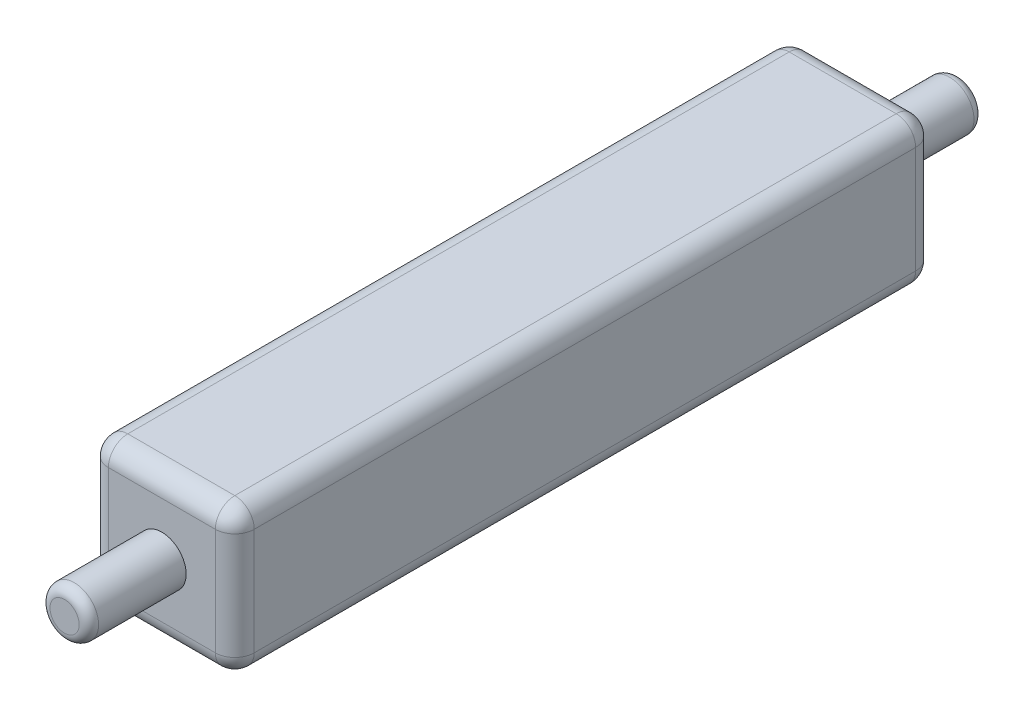
from build123d import *

# Parameters (mm, degrees)
SKETCH1_W           = 15
SKETCH1_H           = 15
BOSS_EXTRUDE1_DEPTH = 72
SKETCH2_R           = 2.5
BOSS_EXTRUDE2_DEPTH = 10
BOSS_EXTRUDE3_START = 10
SKETCH3_R           = 2.5
BOSS_EXTRUDE3_DEPTH = 10
CUT_EXTRUDE1_DEPTH  = 10
FILLET1_R           = 2
FILLET2_R           = 2
FILLET3_R           = 2
FILLET4_R           = 2
FILLET5_R           = 2
FILLET6_R           = 2
FILLET7_R           = 1
FILLET8_R           = 1


with BuildPart() as part:
    # Sketch1 → Boss-Extrude1 (new body)
    with BuildSketch(Plane.XY):
        with Locations((-7.5, 7.5)):
            Rectangle(SKETCH1_W, SKETCH1_H)
    extrude(amount=BOSS_EXTRUDE1_DEPTH)

    # Sketch2 → Boss-Extrude2 (add)
    with BuildSketch(Plane(origin=(0, 0, 0), x_dir=(-1, 0, 0), z_dir=(0, 0, -1))):
        with Locations((7.5, 7.5)):
            Circle(SKETCH2_R)
    extrude(amount=BOSS_EXTRUDE2_DEPTH)

    # Sketch3 → Boss-Extrude3 (add)
    with BuildSketch(Plane.XY.offset(72).offset(BOSS_EXTRUDE3_START)):
        with Locations(Location((-7.5, 7.5, 0), (0, 0, 180))):
            Circle(SKETCH3_R)
    extrude(amount=-BOSS_EXTRUDE3_DEPTH)

    # Sketch5 → Cut-Extrude1 (cut)
    with BuildSketch(Plane.ZY.offset(15)):
        with BuildLine():
            Line((20, 6.306366703), (10, 6.306366703))
            ThreePointArc((10, 6.306366703), (9, 7.306366703), (10, 8.306366703))
            Line((10, 8.306366703), (20, 8.306366703))
            ThreePointArc((20, 8.306366703), (21, 7.306366703), (20, 6.306366703))
        make_face()
        with BuildLine():
            Line((52, 8.306366703), (62, 8.306366703))
            ThreePointArc((62, 8.306366703), (63, 7.306366703), (62, 6.306366703))
            Line((62, 6.306366703), (52, 6.306366703))
            ThreePointArc((52, 6.306366703), (51, 7.306366703), (52, 8.306366703))
        make_face()
    extrude(amount=-CUT_EXTRUDE1_DEPTH, mode=Mode.SUBTRACT)

    # Fillet1
    fillet1_edges = [part.edges().sort_by_distance(p)[0] for p in [
        (-15, 15, 36),
    ]]
    fillet(fillet1_edges, radius=FILLET1_R)

    # Fillet2
    fillet2_edges = [part.edges().sort_by_distance(p)[0] for p in [
        (0, 15, 36),
    ]]
    fillet(fillet2_edges, radius=FILLET2_R)

    # Fillet3
    fillet3_edges = [part.edges().sort_by_distance(p)[0] for p in [
        (0, 0, 36),
    ]]
    fillet(fillet3_edges, radius=FILLET3_R)

    # Fillet4
    fillet4_edges = [part.edges().sort_by_distance(p)[0] for p in [
        (-15, 0, 36),
    ]]
    fillet(fillet4_edges, radius=FILLET4_R)

    # Fillet5
    fillet5_edges = [part.edges().sort_by_distance(p)[0] for p in [
        (-15, 7.5, 0),
        (-14.414213562, 14.414213562, 0),
        (-7.5, 15, 0),
        (-0.585786438, 14.414213562, 0),
        (0, 7.5, 0),
        (-0.585786438, 0.585786438, 0),
        (-7.5, 0, 0),
        (-14.414213562, 0.585786438, 0),
    ]]
    fillet(fillet5_edges, radius=FILLET5_R)

    # Fillet6
    fillet6_edges = [part.edges().sort_by_distance(p)[0] for p in [
        (-15, 7.5, 72),
        (-14.414213562, 14.414213562, 72),
        (-7.5, 15, 72),
        (-0.585786438, 14.414213562, 72),
        (0, 7.5, 72),
        (-0.585786438, 0.585786438, 72),
        (-7.5, 0, 72),
        (-14.414213562, 0.585786438, 72),
    ]]
    fillet(fillet6_edges, radius=FILLET6_R)

    # Fillet7
    fillet7_edges = [part.edges().sort_by_distance(p)[0] for p in [
        (-5, 7.5, 82),
    ]]
    fillet(fillet7_edges, radius=FILLET7_R)

    # Fillet8
    fillet8_edges = [part.edges().sort_by_distance(p)[0] for p in [
        (-5, 7.5, -10),
    ]]
    fillet(fillet8_edges, radius=FILLET8_R)


solid = part.part
